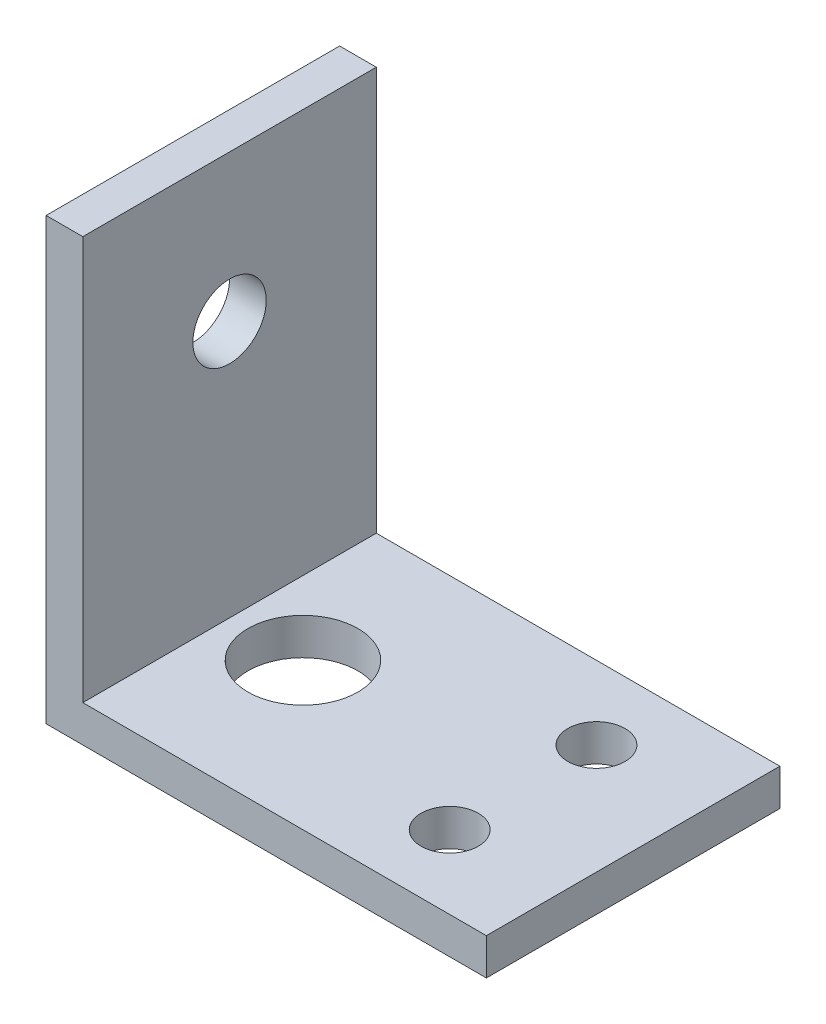
from build123d import *

# Parameters (mm, degrees)
EXTRUDE_THIN1_DEPTH = 25.4
SKETCH2_R           = 4.7625
CUT_EXTRUDE1_DEPTH  = 58.589283942
SKETCH3_R           = 2.4765
CUT_EXTRUDE2_DEPTH  = 60.56828015
SKETCH4_R           = 3.175
CUT_EXTRUDE3_DEPTH  = 60.56828015


with BuildPart() as part:
    # Sketch1 → Extrude-Thin1 (new body)
    with BuildSketch(Plane.XY):
        Polygon((0, 38.1), (0, 0), (38.1, 0), (38.1, 3.175), (3.175, 3.175), (3.175, 38.1), align=None)
    extrude(amount=EXTRUDE_THIN1_DEPTH)

    # Sketch2 → Cut-Extrude1 (cut, through all)
    with BuildSketch(Plane(origin=(0, 3.175, 0), x_dir=(1, 0, 0), z_dir=(0, 1, 0))):
        with Locations(Location((9.525, -12.7, 0), (0, 0, 270))):
            Circle(SKETCH2_R)
    extrude(amount=-CUT_EXTRUDE1_DEPTH, mode=Mode.SUBTRACT)

    # Sketch3 → Cut-Extrude2 (cut, through all)
    with BuildSketch(Plane.XZ):
        with Locations(Location((28.575, 19.05, 0), (0, 0, 270))):
            Circle(SKETCH3_R)
        with Locations(Location((28.575, 6.35, 0), (0, 0, 270))):
            Circle(SKETCH3_R)
    extrude(amount=-CUT_EXTRUDE2_DEPTH, mode=Mode.SUBTRACT)

    # Sketch4 → Cut-Extrude3 (cut, through all)
    with BuildSketch(Plane.ZY):
        with Locations((12.7, 25.4)):
            Circle(SKETCH4_R)
    extrude(amount=-CUT_EXTRUDE3_DEPTH, mode=Mode.SUBTRACT)


solid = part.part
